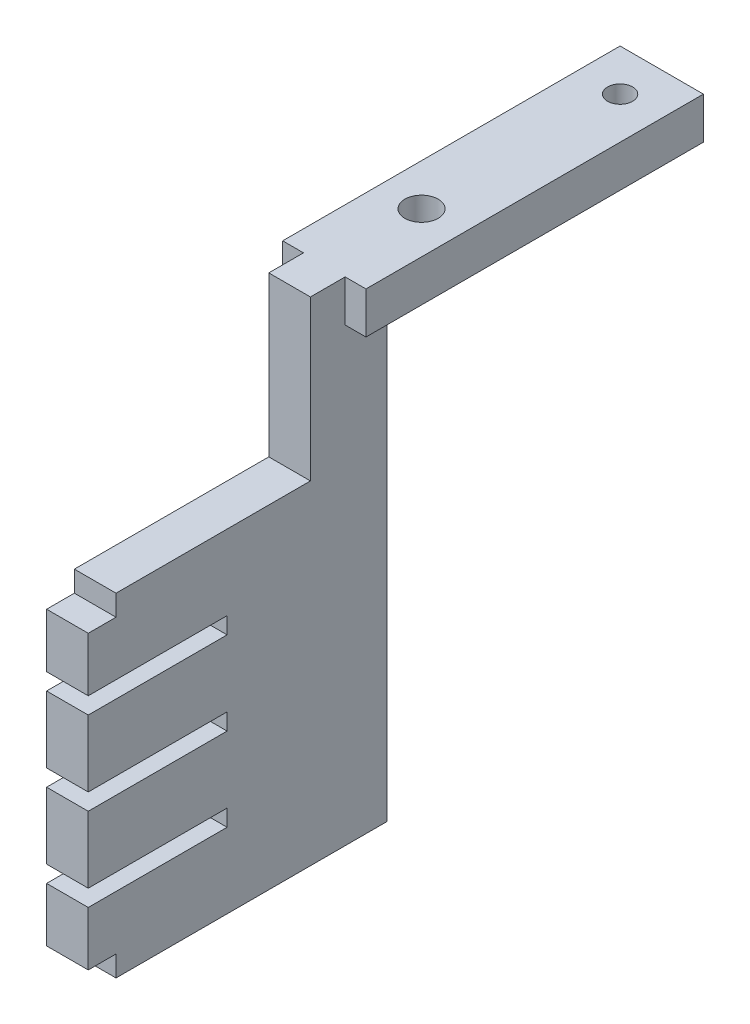
from build123d import *

# Parameters (mm, degrees)
BOSS_EXTRUDE1_START     = 7.2
SKETCH1_W               = 6
SKETCH1_H               = 3
BOSS_EXTRUDE1_DEPTH     = 24.3
BOSS_EXTRUDE2_START     = 28.5
SKETCH2_W               = 3
SKETCH2_H               = 35.475
BOSS_EXTRUDE2_DEPTH     = 21.5
CUT_EXTRUDE1_DEPTH      = 60.023009285
CUT_EXTRUDE1_DEPTH_BACK = 60.023009285
SKETCH3_R               = 1.2
SKETCH3_R_2             = 0.9
CUT_EXTRUDE2_DEPTH      = 60.023009285
CUT_EXTRUDE2_DEPTH_BACK = 60.023009285
SKETCH4_W               = 11
SKETCH4_H               = 1.2
SKETCH4_W_2             = 17
SKETCH4_H_2             = 12.475
CUT_EXTRUDE3_DEPTH      = 60.023009285
CUT_EXTRUDE3_DEPTH_BACK = 60.023009285
SKETCH5_W               = 3
SKETCH5_H               = 2.5


with BuildPart() as part:
    # Sketch1 → Boss-Extrude1 (new body)
    with BuildSketch(Plane.XY.offset(BOSS_EXTRUDE1_START)):
        with Locations((17.8, 21.975)):
            Rectangle(SKETCH1_W, SKETCH1_H)
    extrude(amount=BOSS_EXTRUDE1_DEPTH)

    # Sketch2 → Boss-Extrude2 (add)
    with BuildSketch(Plane.XY.offset(BOSS_EXTRUDE2_START)):
        with Locations((17.8, 5.7375)):
            Rectangle(SKETCH2_W, SKETCH2_H)
    extrude(amount=BOSS_EXTRUDE2_DEPTH)

    # Sketch3 → Cut-Extrude1 (cut, two sides: drawn at the far end of the back side and taken through both)
    with BuildSketch(Plane(origin=(0, 0, 0), x_dir=(1, 0, 0), z_dir=(0, 1, 0)).offset(-CUT_EXTRUDE1_DEPTH_BACK)):
        with Locations(Location((17.8, -24.5, 0), (0, 0, 270))):
            Circle(SKETCH3_R)
        with Locations(Location((17.8, -10.2, 0), (0, 0, 270))):
            Circle(SKETCH3_R_2)
    extrude(amount=CUT_EXTRUDE1_DEPTH + CUT_EXTRUDE1_DEPTH_BACK, mode=Mode.SUBTRACT)

    # Sketch4 → Cut-Extrude2 (cut, two sides: drawn at the far end of the back side and taken through both)
    with BuildSketch(Plane(origin=(0, 0, 0), x_dir=(0, 0, -1), z_dir=(1, 0, 0)).offset(-CUT_EXTRUDE2_DEPTH_BACK)):
        with Locations((-45.5, -6)):
            Rectangle(SKETCH4_W, SKETCH4_H)
        with Locations((-45.5, 0)):
            Rectangle(SKETCH4_W, SKETCH4_H)
        with Locations((-45.5, 6)):
            Rectangle(SKETCH4_W, SKETCH4_H)
        with Locations((-42.5, 18.2375)):
            Rectangle(SKETCH4_W_2, SKETCH4_H_2)
    extrude(amount=CUT_EXTRUDE2_DEPTH + CUT_EXTRUDE2_DEPTH_BACK, mode=Mode.SUBTRACT)

    # Sketch5 → Cut-Extrude3 (cut, two sides: drawn at the far end of the back side and taken through both)
    with BuildSketch(Plane(origin=(0, 0, 0), x_dir=(0, 0, -1), z_dir=(1, 0, 0)).offset(-CUT_EXTRUDE3_DEPTH_BACK)):
        with Locations((-49.5, -11.75)):
            Rectangle(SKETCH5_W, SKETCH5_H)
        with Locations((-49.5, 11.75)):
            Rectangle(SKETCH5_W, SKETCH5_H)
    extrude(amount=CUT_EXTRUDE3_DEPTH + CUT_EXTRUDE3_DEPTH_BACK, mode=Mode.SUBTRACT)


solid = part.part
